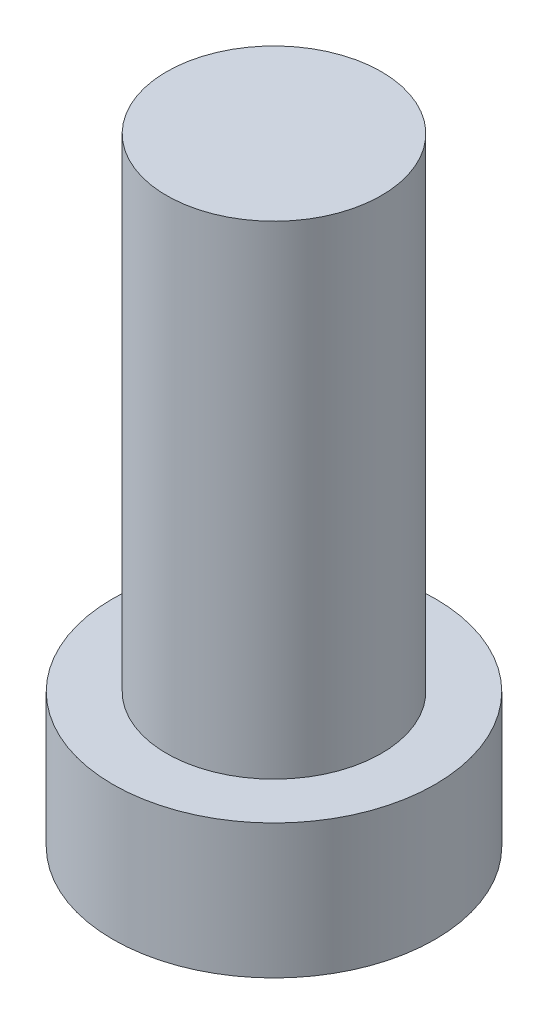
from build123d import *

# Parameters (mm, degrees)
SKETCH1_R           = 30
BOSS_EXTRUDE1_DEPTH = 25
SKETCH2_R           = 20
BOSS_EXTRUDE2_DEPTH = 90


with BuildPart() as part:
    # Sketch1 → Boss-Extrude1 (new body)
    with BuildSketch(Plane(origin=(0, 0, 0), x_dir=(1, 0, 0), z_dir=(0, 1, 0))):
        Circle(SKETCH1_R)
    extrude(amount=BOSS_EXTRUDE1_DEPTH)

    # Sketch2 → Boss-Extrude2 (add)
    with BuildSketch(Plane(origin=(0, 25, 0), x_dir=(1, 0, 0), z_dir=(0, 1, 0))):
        Circle(SKETCH2_R)
    extrude(amount=BOSS_EXTRUDE2_DEPTH)


solid = part.part
